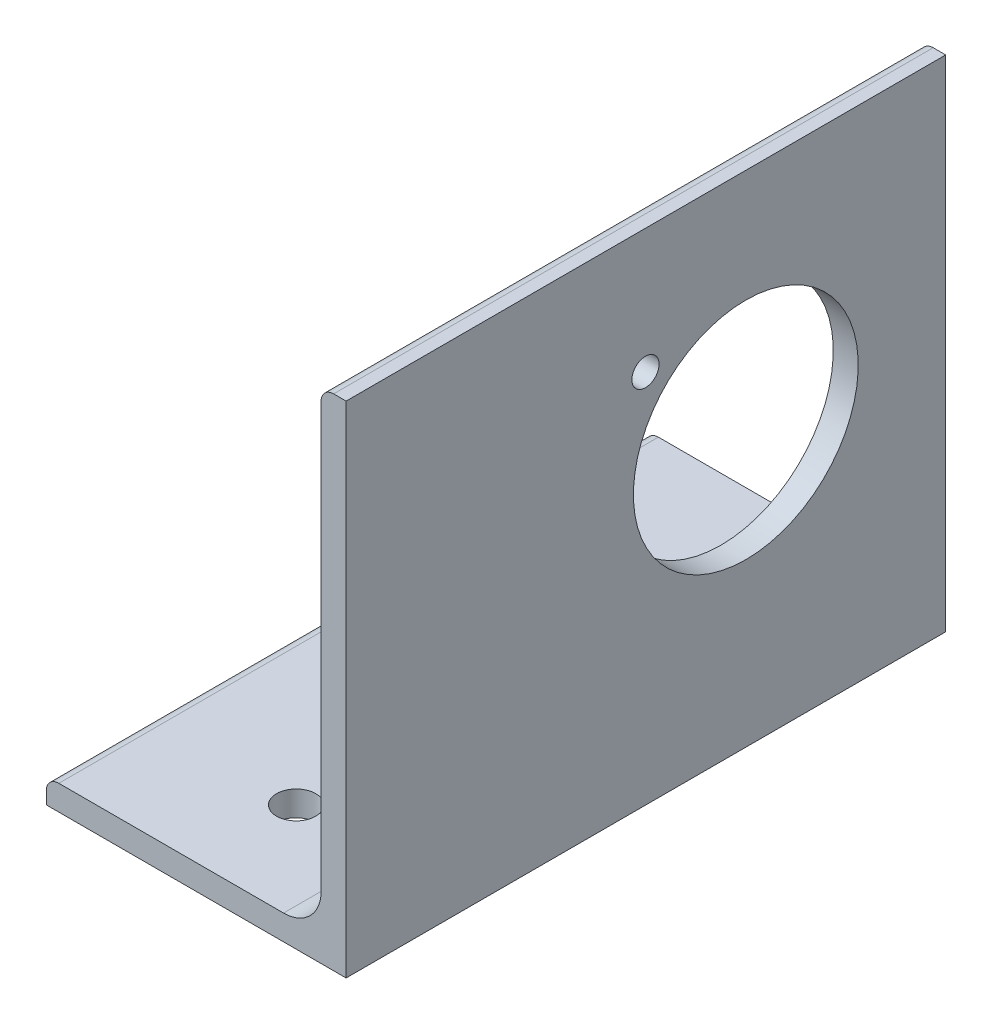
from build123d import *

# Parameters (mm, degrees)
BOSS_EXTRUDE1_DEPTH = 38.1
SKETCH3_R           = 14.2875
SKETCH3_R_2         = 1.7272
CUT_EXTRUDE1_DEPTH  = 61.658289829
SKETCH9_R           = 2.4892
CUT_EXTRUDE2_DEPTH  = 77.464125575


with BuildPart() as part:
    # Sketch2 → Boss-Extrude1 (new, symmetric)
    with BuildSketch(Plane.XY):
        with BuildLine():
            Line((-19.05, -31.75), (19.05, -31.75))
            Line((19.05, -31.75), (19.05, 31.75))
            Line((19.05, 31.75), (17.4625, 31.75))
            ThreePointArc((17.4625, 31.75), (16.339967985, 31.285032015), (15.875, 30.1625))
            Line((15.875, 30.1625), (15.875, -23.7998))
            ThreePointArc((15.875, -23.7998), (14.476376302, -27.176376302), (11.0998, -28.575))
            Line((11.0998, -28.575), (-17.4625, -28.575))
            ThreePointArc((-17.4625, -28.575), (-18.585032015, -29.039967985), (-19.05, -30.1625))
            Line((-19.05, -30.1625), (-19.05, -31.75))
        make_face()
    extrude(amount=BOSS_EXTRUDE1_DEPTH, both=True)

    # Sketch3 → Cut-Extrude1 (cut, through all)
    with BuildSketch(Plane.ZY.offset(-15.875)):
        with Locations(Location((-12.700000198, 3.178175, 0), (0, 0, 270))):
            Circle(SKETCH3_R)
        with Locations(Location((0.051963493, 15.930138692, 0), (0, 0, 270))):
            Circle(SKETCH3_R_2)
    extrude(amount=-CUT_EXTRUDE1_DEPTH, mode=Mode.SUBTRACT)

    # Sketch9 → Cut-Extrude2 (cut, through all)
    with BuildSketch(Plane.XZ.offset(31.75)):
        with Locations((0, 25.4)):
            Circle(SKETCH9_R)
        Circle(SKETCH9_R)
    extrude(amount=-CUT_EXTRUDE2_DEPTH, mode=Mode.SUBTRACT)


solid = part.part
